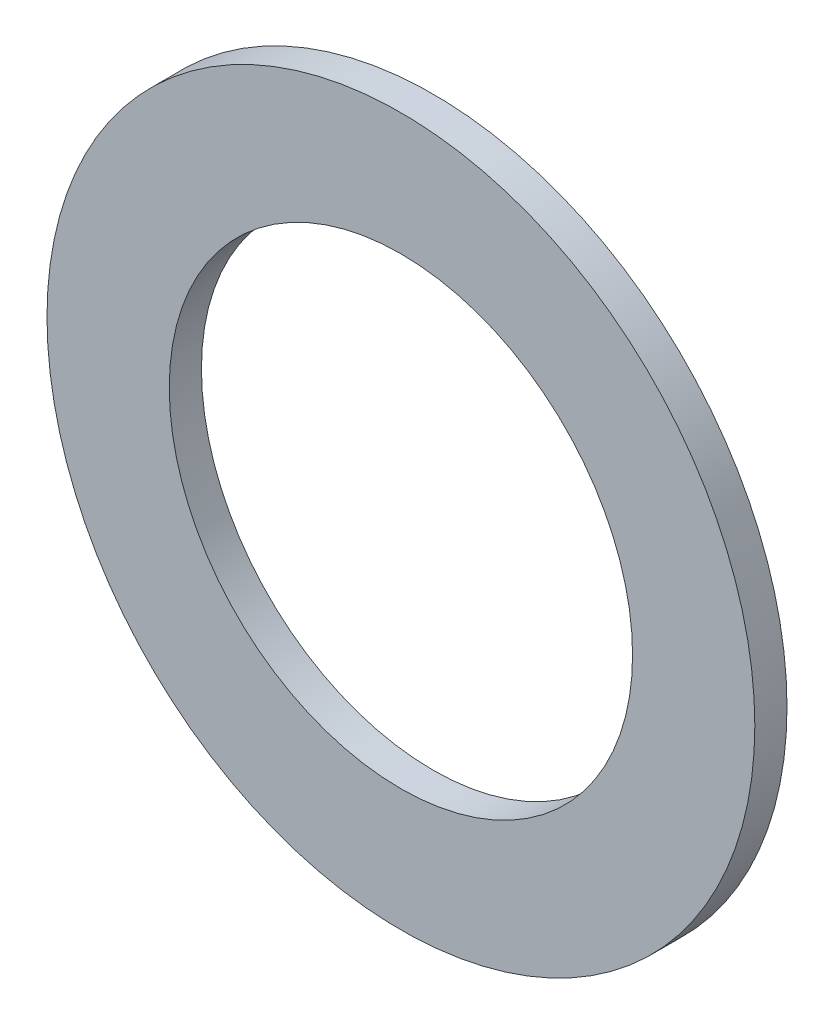
from build123d import *

# Parameters (mm, degrees)
F_0169_CYLINDER_SKETCH_R = 5.5
F_0169_CYLINDER_DEPTH    = 0.5
F_0170_CYLINDER_SKETCH_R = 3.6
F_0170_CYLINDER_DEPTH    = 2


with BuildPart() as part:
    # 0169_cylinder_Sketch → 0169_cylinder (new body)
    with BuildSketch(Plane.XY):
        Circle(F_0169_CYLINDER_SKETCH_R)
    extrude(amount=F_0169_CYLINDER_DEPTH)


with BuildPart() as body_2:
    # 0170_cylinder_Sketch → 0170_cylinder (new body)
    with BuildSketch(Plane.XY):
        Circle(F_0170_CYLINDER_SKETCH_R)
    extrude(amount=F_0170_CYLINDER_DEPTH)


with BuildPart() as body_2_1:
    # 0170_cylinder_Translate: moved
    add(body_2.part.moved(Location((0, 0, -1))))


with BuildPart() as part_1:
    add(part.part)

    # 0171_sub: cut body 2
    add(body_2_1.part, mode=Mode.SUBTRACT)


solid = part_1.part
